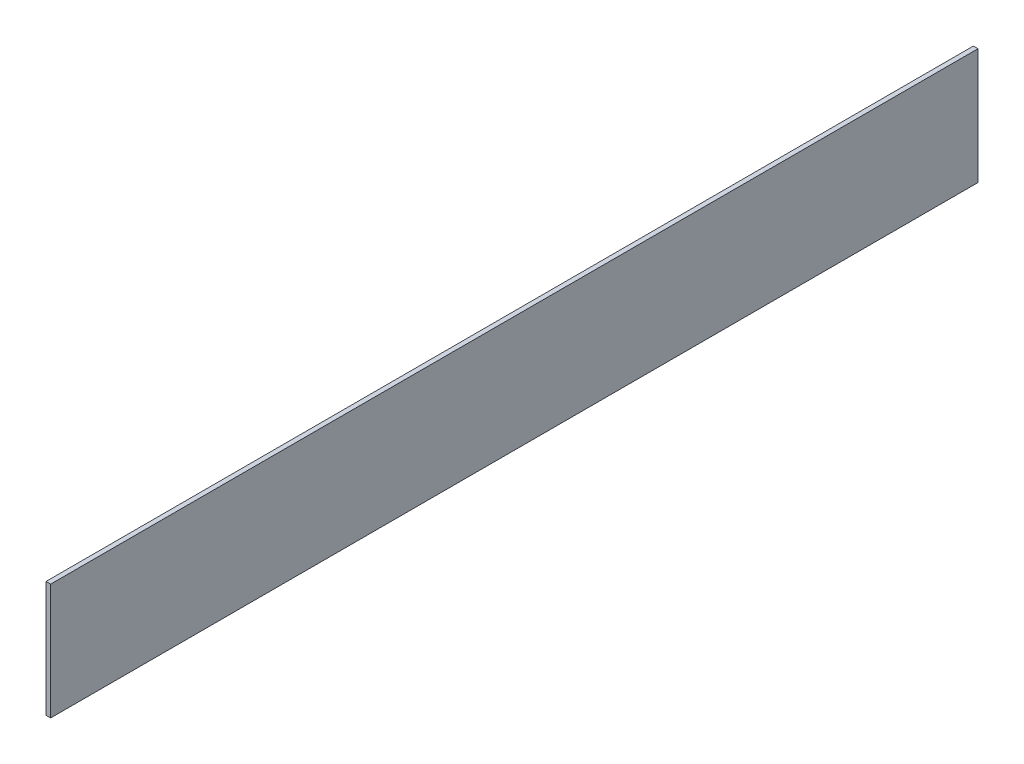
from build123d import *

# Parameters (mm, degrees)
SKETCH1_W              = 1.6
SKETCH1_H              = 40
KUTU_DUVAR_SOL_1_DEPTH = 320


with BuildPart() as part:
    # Sketch1 → KUTU_duvar_sol_1 (new body)
    with BuildSketch(Plane.XY):
        with Locations((0.8, 21.6)):
            Rectangle(SKETCH1_W, SKETCH1_H)
    extrude(amount=-KUTU_DUVAR_SOL_1_DEPTH)


solid = part.part
